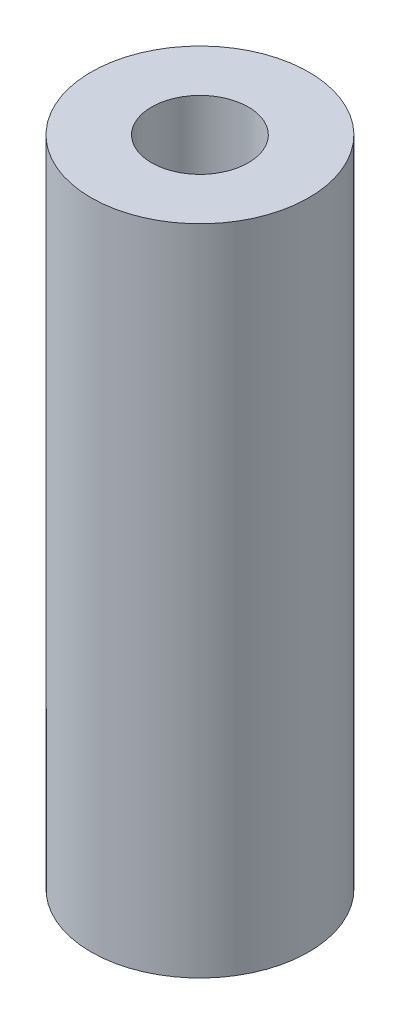
from build123d import *

# Parameters (mm, degrees)
SKETCH1_R           = 4.5
SKETCH1_R_2         = 2
BOSS_EXTRUDE1_DEPTH = 27


with BuildPart() as part:
    # Sketch1 → Boss-Extrude1 (new body)
    with BuildSketch(Plane(origin=(0, 0, 0), x_dir=(1, 0, 0), z_dir=(0, 1, 0))):
        with Locations(Location((0, 0, 0), (0, 0, 270))):
            Circle(SKETCH1_R)
        with Locations(Location((0, 0, 0), (0, 0, 270))):
            Circle(SKETCH1_R_2, mode=Mode.SUBTRACT)
    extrude(amount=BOSS_EXTRUDE1_DEPTH)


solid = part.part
